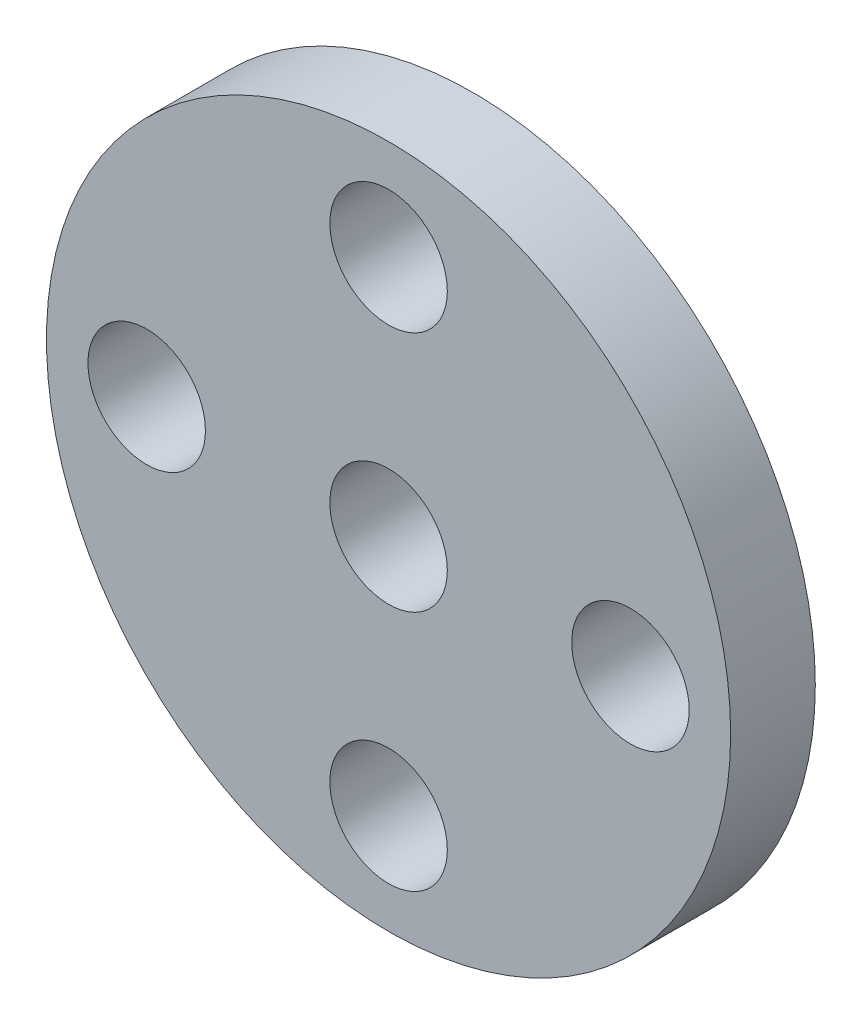
from build123d import *

# Parameters (mm, degrees)
SKETCH1_R           = 9.9
SKETCH1_R_2         = 1.7
BOSS_EXTRUDE2_DEPTH = 2.45
SKETCH2_R           = 4.5
SKETCH2_R_2         = 2.006415725
BOSS_EXTRUDE3_DEPTH = 2.05


with BuildPart() as part:
    # Sketch1 → Boss-Extrude2 (new body)
    with BuildSketch(Plane.XY):
        with Locations((19.5, 0)):
            Circle(SKETCH1_R)
        with Locations((19.5, 0)):
            Circle(SKETCH1_R_2, mode=Mode.SUBTRACT)
        with Locations((12.5, 0)):
            Circle(SKETCH1_R_2, mode=Mode.SUBTRACT)
        with Locations((19.5, 7)):
            Circle(SKETCH1_R_2, mode=Mode.SUBTRACT)
        with Locations((26.5, 0)):
            Circle(SKETCH1_R_2, mode=Mode.SUBTRACT)
        with Locations((19.5, -7)):
            Circle(SKETCH1_R_2, mode=Mode.SUBTRACT)
    extrude(amount=-BOSS_EXTRUDE2_DEPTH)

    # Sketch2 → Boss-Extrude3 (add)
    with BuildSketch(Plane(origin=(0, 0, -2.45), x_dir=(-1, 0, 0), z_dir=(0, 0, -1))):
        with Locations(Location((-19.5, 0, 0), (0, 0, 180))):
            Circle(SKETCH2_R)
        with Locations((-19.5, 0)):
            Circle(SKETCH2_R_2, mode=Mode.SUBTRACT)
    extrude(amount=BOSS_EXTRUDE3_DEPTH)


solid = part.part
